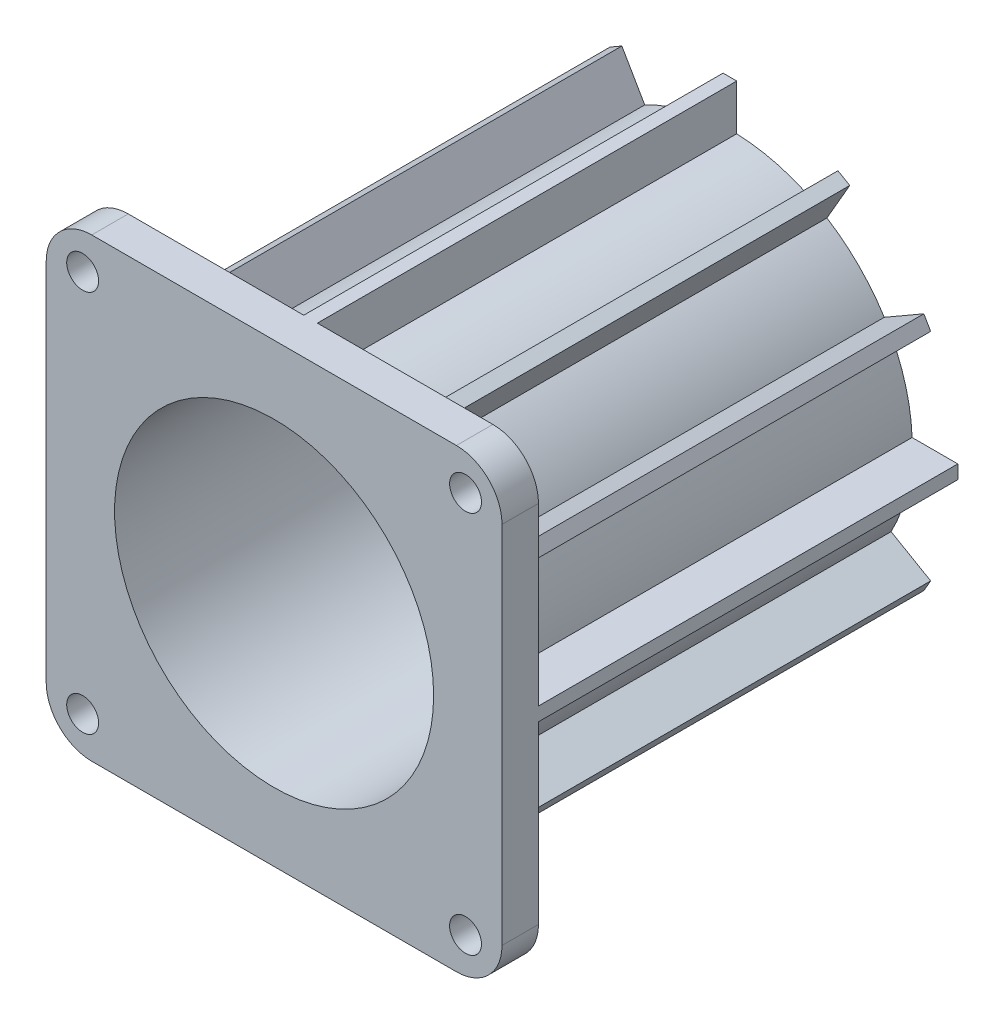
from build123d import *

# Parameters (mm, degrees)
SKETCH_1_R               = 40
EXTRUDE_1_DEPTH          = 100
SKETCH_2_R               = 35
CUT_EXTRUDE_1_DEPTH      = 92
SKETCH_3_R               = 35
EXTRUDE_2_DEPTH          = 8
SKETCH_4_W               = 3
SKETCH_4_H               = 11
EXTRUDE_3_DEPTH          = 92
PATTERN_CIRCULAR_1_COUNT = 12
SKETCH_5_R               = 11
CUT_EXTRUDE_2_DEPTH      = 8
SKETCH_6_R               = 3.5
CUT_EXTRUDE_3_DEPTH      = 8
SKETCH_7_R               = 2.25
CUT_EXTRUDE_4_DEPTH      = 8


with BuildPart() as part:
    # 草图1 → 凸台-拉伸1 (new body)
    with BuildSketch(Plane.XY):
        Circle(SKETCH_1_R)
    extrude(amount=EXTRUDE_1_DEPTH)

    # 草图2 → 切除-拉伸1 (cut)
    with BuildSketch(Plane.XY.offset(8)):
        Circle(SKETCH_2_R)
    extrude(amount=CUT_EXTRUDE_1_DEPTH, mode=Mode.SUBTRACT)

    # 草图3 → 凸台-拉伸2 (add)
    with BuildSketch(Plane.XY.offset(92)):
        with BuildLine():
            Line((-40, -50), (40, -50))
            ThreePointArc((40, -50), (47.071067812, -47.071067812), (50, -40))
            Line((50, -40), (50, 40))
            ThreePointArc((50, 40), (47.071067812, 47.071067812), (40, 50))
            Line((40, 50), (-40, 50))
            ThreePointArc((-40, 50), (-47.071067812, 47.071067812), (-50, 40))
            Line((-50, 40), (-50, -40))
            ThreePointArc((-50, -40), (-47.071067812, -47.071067812), (-40, -50))
        make_face()
        Circle(SKETCH_3_R, mode=Mode.SUBTRACT)
    extrude(amount=EXTRUDE_2_DEPTH)

    # 草图4 → 凸台-拉伸3 (add)
    with BuildSketch(Plane.XY):
        with Locations((0, 44.5)):
            Rectangle(SKETCH_4_W, SKETCH_4_H)
    extrude_3 = extrude(amount=EXTRUDE_3_DEPTH)

    # 阵列(圆周)1: 凸台-拉伸3 ×12 about axis
    pattern_circular_1_axis = Axis((0, 0, 105), (0, 0, -1))
    for i in range(1, PATTERN_CIRCULAR_1_COUNT):
        add(extrude_3.rotate(pattern_circular_1_axis, i * 360 / PATTERN_CIRCULAR_1_COUNT))

    # 草图5 → 切除-拉伸2 (cut)
    with BuildSketch(Plane.XY):
        Circle(SKETCH_5_R)
    extrude(amount=CUT_EXTRUDE_2_DEPTH, mode=Mode.SUBTRACT)

    # 草图6 → 切除-拉伸3 (cut)
    with BuildSketch(Plane.XY.offset(100)):
        with Locations((42, 42)):
            Circle(SKETCH_6_R)
        with Locations((-42, 42)):
            Circle(SKETCH_6_R)
        with Locations((-42, -42)):
            Circle(SKETCH_6_R)
        with Locations((42, -42)):
            Circle(SKETCH_6_R)
    extrude(amount=-CUT_EXTRUDE_3_DEPTH, mode=Mode.SUBTRACT)

    # 草图7 → 切除-拉伸4 (cut)
    with BuildSketch(Plane.XY):
        with Locations((14.142136, 14.142136)):
            Circle(SKETCH_7_R)
        with Locations((-14.142136, 14.142136)):
            Circle(SKETCH_7_R)
        with Locations((-14.142136, -14.142136)):
            Circle(SKETCH_7_R)
        with Locations((14.142136, -14.142136)):
            Circle(SKETCH_7_R)
    extrude(amount=CUT_EXTRUDE_4_DEPTH, mode=Mode.SUBTRACT)


solid = part.part
